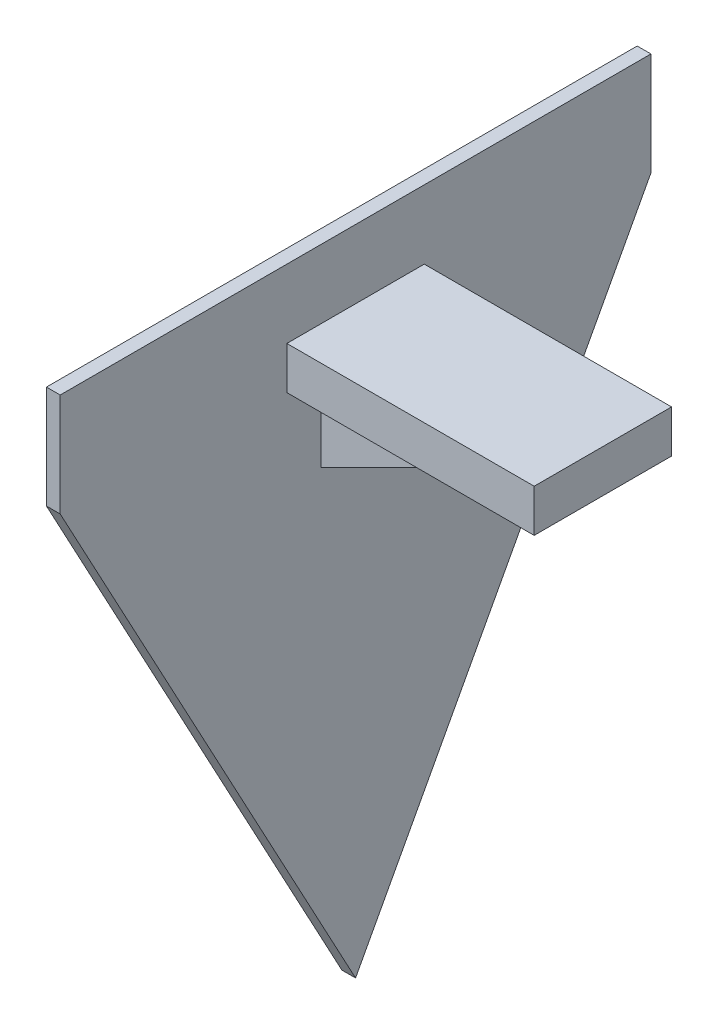
from build123d import *

# Parameters (mm, degrees)
BOSS_EXTRUDE1_DEPTH = 2
SKETCH2_W           = 20
SKETCH2_H           = 6.2
BOSS_EXTRUDE2_DEPTH = 36
BOSS_EXTRUDE3_DEPTH = 5


with BuildPart() as part:
    # Sketch1 → Boss-Extrude1 (new body)
    with BuildSketch(Plane(origin=(0, 0, 0), x_dir=(0, 0, -1), z_dir=(1, 0, 0))):
        Polygon((-43, 47.5), (43, 47.5), (43, 32.5), (0, -47.5), (-43, 32.5), align=None)
    extrude(amount=BOSS_EXTRUDE1_DEPTH)

    # Sketch2 → Boss-Extrude2 (add)
    with BuildSketch(Plane(origin=(2, 0, 0), x_dir=(0, 0, -1), z_dir=(1, 0, 0))):
        with Locations((0, 34.4)):
            Rectangle(SKETCH2_W, SKETCH2_H)
    extrude(amount=BOSS_EXTRUDE2_DEPTH)

    # Sketch3 → Boss-Extrude3 (add, symmetric)
    with BuildSketch(Plane.XY):
        Polygon((2, 19.36818927), (25.86362146, 31.3), (12, 31.3), (2, 26.3), align=None)
    extrude(amount=BOSS_EXTRUDE3_DEPTH, both=True)


solid = part.part
